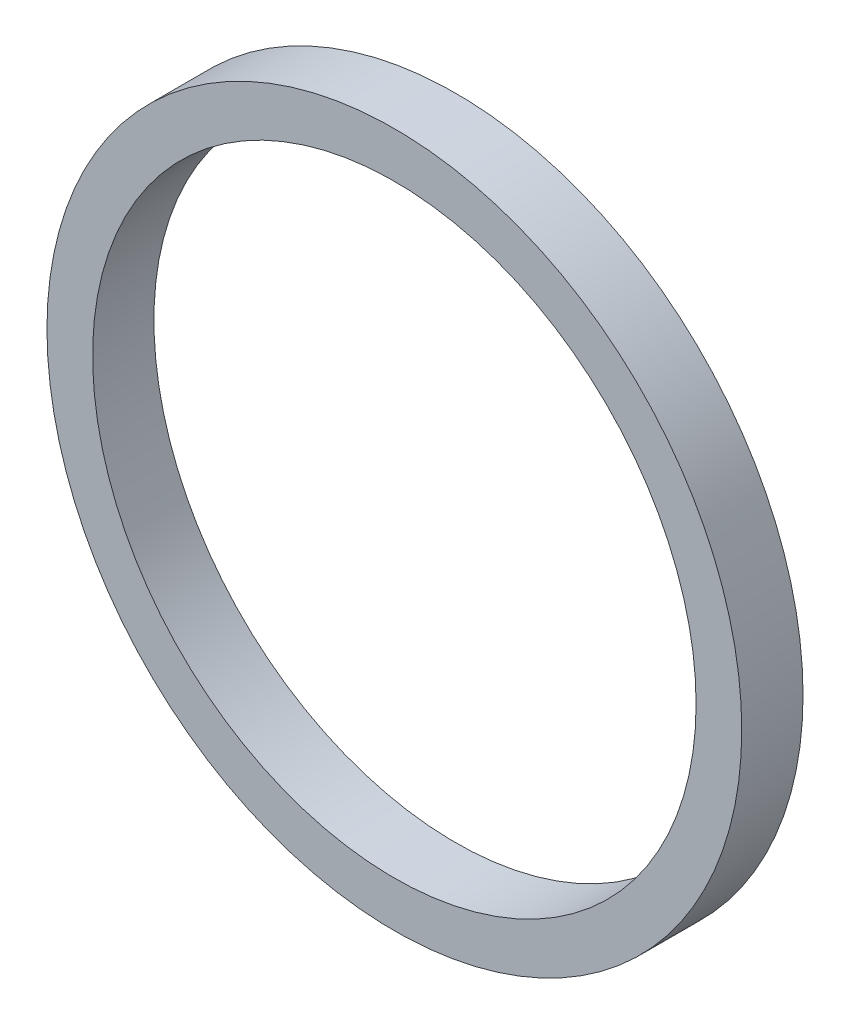
from build123d import *

# Parameters (mm, degrees)
SKETCH1_W = 0.558241758
SKETCH1_H = 0.749364756


with BuildPart() as part:
    # Sketch1 → Revolve1 (revolve)
    with BuildSketch(Plane(origin=(0, 0, 0), x_dir=(1, 0, 0), z_dir=(0, 1, 0))):
        with Locations((3.96875, 1.133442622)):
            Rectangle(SKETCH1_W, SKETCH1_H)
    revolve(axis=Axis((0, 0, -1.508125), (0, 0, 1)))


solid = part.part
